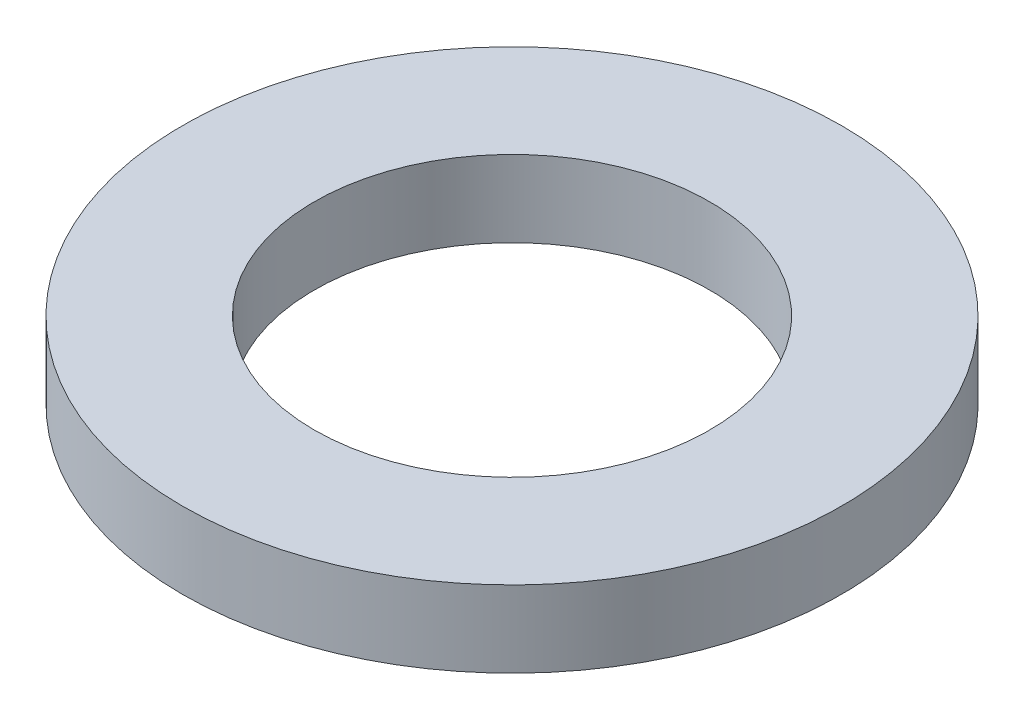
from build123d import *

# Parameters (mm, degrees)
SKETCH_1_R      = 25
SKETCH_1_R_2    = 15
EXTRUDE_1_DEPTH = 5.8


with BuildPart() as part:
    # 草图1 → 凸台-拉伸1 (new body)
    with BuildSketch(Plane(origin=(0, 0, 0), x_dir=(1, 0, 0), z_dir=(0, 1, 0))):
        with Locations(Location((0, 0, 0), (0, 0, 270))):
            Circle(SKETCH_1_R)
        with Locations(Location((0, 0, 0), (0, 0, 270))):
            Circle(SKETCH_1_R_2, mode=Mode.SUBTRACT)
    extrude(amount=EXTRUDE_1_DEPTH)


solid = part.part
